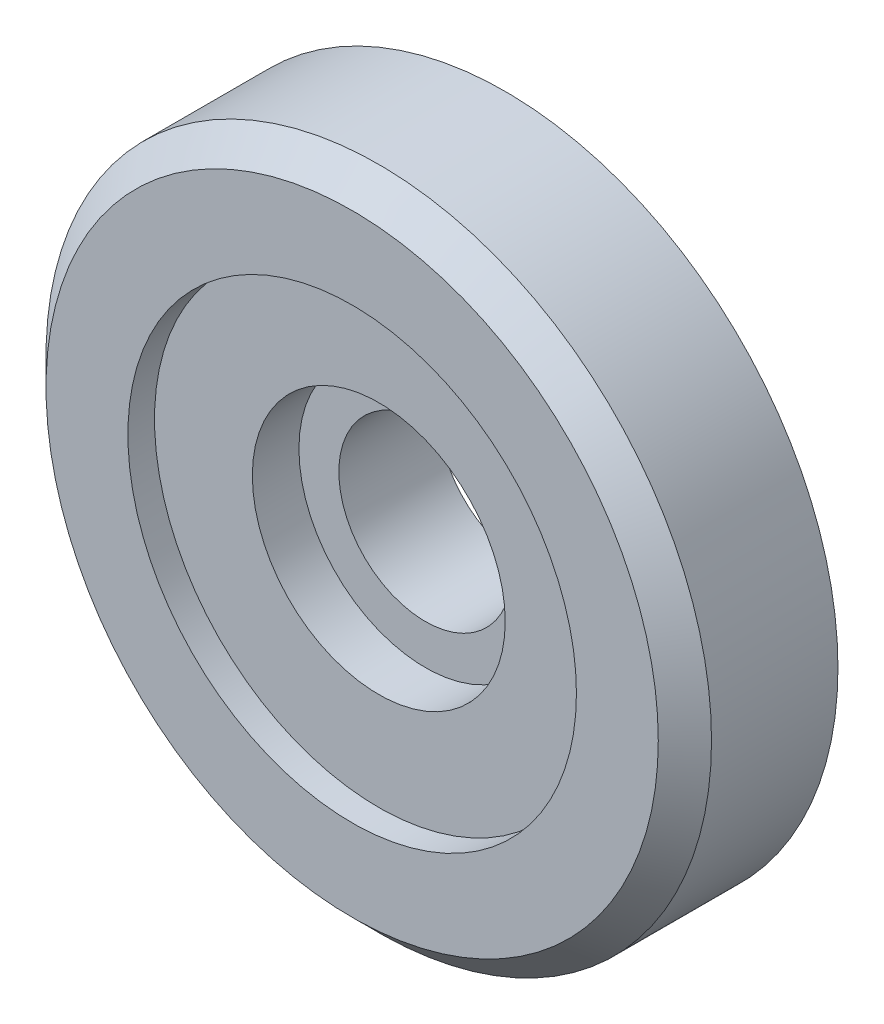
from build123d import *

# Parameters (mm, degrees)
CROQUIS1_R              = 25
SALIENTE_EXTRUIR1_DEPTH = 11.5
CROQUIS2_R              = 16.85
CORTAR_EXTRUIR1_DEPTH   = 2
CROQUIS3_R              = 9.5
CORTAR_EXTRUIR2_DEPTH   = 3.5
CORTAR_EXTRUIR3_REACH   = 37.861
CROQUIS4_R              = 6.5
CROQUIS5_R              = 11
CROQUIS5_R_2            = 6.5
SALIENTE_EXTRUIR2_DEPTH = 1.5
CHAFL_N1_SIZE           = 2


with BuildPart() as part:
    # Croquis1 → Saliente-Extruir1 (new body)
    with BuildSketch(Plane.XY):
        Circle(CROQUIS1_R)
    extrude(amount=-SALIENTE_EXTRUIR1_DEPTH)

    # Croquis2 → Cortar-Extruir1 (cut)
    with BuildSketch(Plane.XY):
        Circle(CROQUIS2_R)
    extrude(amount=-CORTAR_EXTRUIR1_DEPTH, mode=Mode.SUBTRACT)

    # Croquis3 → Cortar-Extruir2 (cut)
    with BuildSketch(Plane.XY.offset(-2)):
        Circle(CROQUIS3_R)
    extrude(amount=-CORTAR_EXTRUIR2_DEPTH, mode=Mode.SUBTRACT)

    # Croquis4 → Cortar-Extruir3 (cut, up to next)
    with BuildSketch(Plane.XY.offset(-5.5), mode=Mode.PRIVATE) as cortar_extruir3_sk1:
        Circle(CROQUIS4_R)
    cortar_extruir3_tool1 = extrude(cortar_extruir3_sk1.sketch, amount=-CORTAR_EXTRUIR3_REACH, mode=Mode.PRIVATE) & part.part
    add(cortar_extruir3_tool1.solids().sort_by_distance((0, 0, -5.5))[0], mode=Mode.SUBTRACT)

    # Croquis5 → Saliente-Extruir2 (add)
    with BuildSketch(Plane(origin=(0, 0, -11.5), x_dir=(-1, 0, 0), z_dir=(0, 0, -1))):
        with Locations(Location((0, 0, 0), (0, 0, 180))):
            Circle(CROQUIS5_R)
        with Locations(Location((0, 0, 0), (0, 0, 180))):
            Circle(CROQUIS5_R_2, mode=Mode.SUBTRACT)
    extrude(amount=SALIENTE_EXTRUIR2_DEPTH)

    # Chaflán1
    chafl_n1_edges = [part.edges().sort_by_distance(p)[0] for p in [
        (-25, 0, 0),
    ]]
    chamfer(chafl_n1_edges, length=CHAFL_N1_SIZE)


solid = part.part
